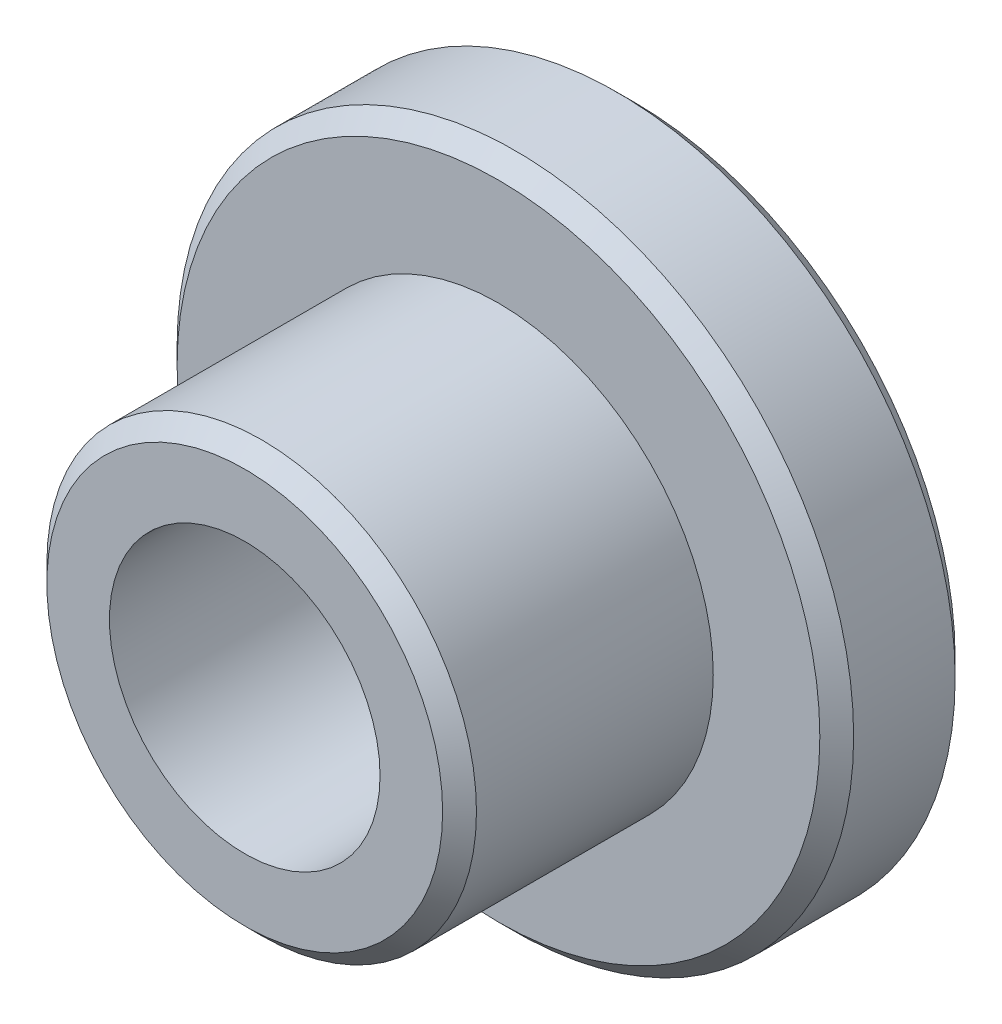
from build123d import *

# Parameters (mm, degrees)
ESBO_O1_R                = 20
RESSALTO_EXTRUS_O1_DEPTH = 8
ESBO_O2_R                = 12.7
RESSALTO_EXTRUS_O2_DEPTH = 15
CHANFRO1_SIZE            = 1
ESBO_O3_R                = 8
CORTE_EXTRUS_O1_DEPTH    = 15
ESBO_O4_R                = 6
CORTE_EXTRUS_O2_DEPTH    = 37.455452267
CHANFRO2_SIZE            = 1


with BuildPart() as part:
    # Esboço1 → Ressalto-extrusão1 (new body)
    with BuildSketch(Plane.XY):
        Circle(ESBO_O1_R)
    extrude(amount=RESSALTO_EXTRUS_O1_DEPTH)

    # Esboço2 → Ressalto-extrusão2 (add)
    with BuildSketch(Plane.XY.offset(8)):
        Circle(ESBO_O2_R)
    extrude(amount=RESSALTO_EXTRUS_O2_DEPTH)

    # Chanfro1
    chanfro1_edges = [part.edges().sort_by_distance(p)[0] for p in [
        (-12.7, 0, 23),
    ]]
    chamfer(chanfro1_edges, length=CHANFRO1_SIZE)

    # Esboço3 → Corte-extrusão1 (cut)
    with BuildSketch(Plane.XY.offset(23)):
        Circle(ESBO_O3_R)
    extrude(amount=-CORTE_EXTRUS_O1_DEPTH, mode=Mode.SUBTRACT)

    # Esboço4 → Corte-extrusão2 (cut, through all)
    with BuildSketch(Plane(origin=(0, 0, 0), x_dir=(-1, 0, 0), z_dir=(0, 0, -1))):
        Circle(ESBO_O4_R)
    extrude(amount=-CORTE_EXTRUS_O2_DEPTH, mode=Mode.SUBTRACT)

    # Chanfro2
    chanfro2_edges = [part.edges().sort_by_distance(p)[0] for p in [
        (-20, 0, 0),
        (-20, 0, 8),
    ]]
    chamfer(chanfro2_edges, length=CHANFRO2_SIZE)


solid = part.part
